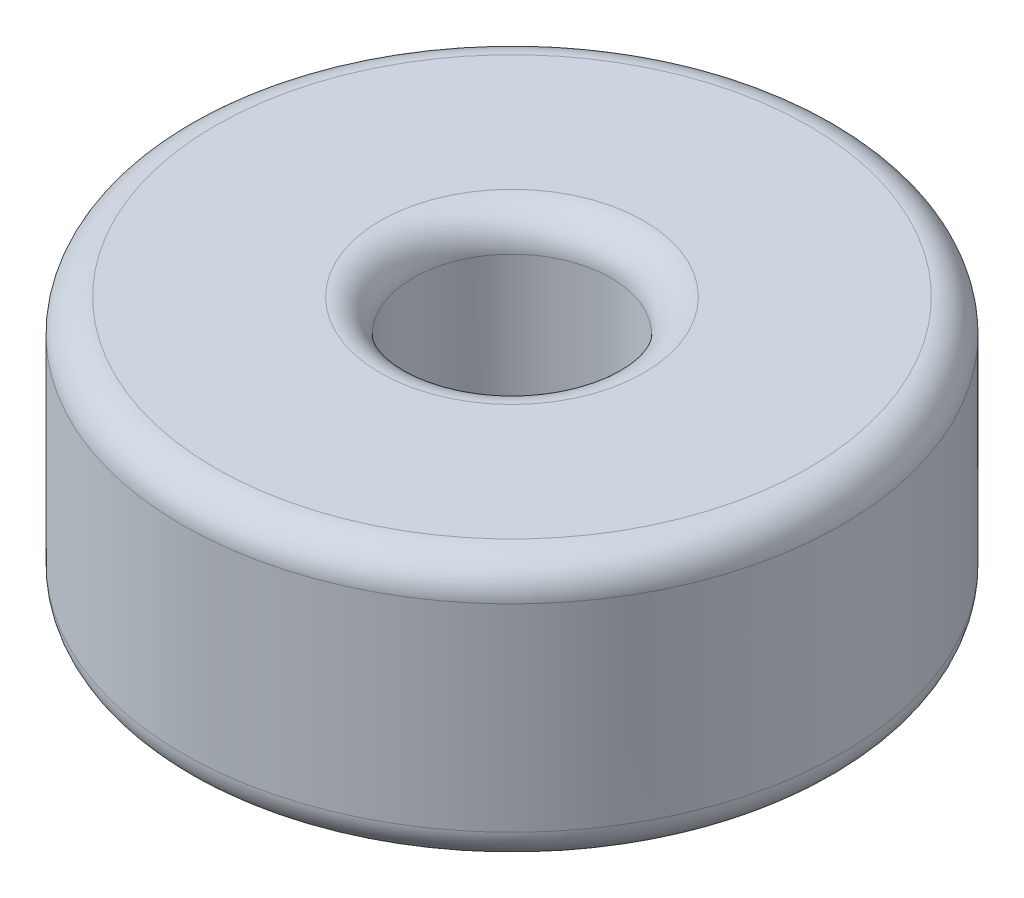
from build123d import *

# Parameters (mm, degrees)
ESQUISSE1_W = 3.5
ESQUISSE1_H = 4
CONG_1_R    = 0.5


with BuildPart() as part:
    # Esquisse1 → Révolution1 (revolve)
    with BuildSketch(Plane.XY, mode=Mode.PRIVATE) as r_volution1_sk:
        with Locations((3.25, 2)):
            Rectangle(ESQUISSE1_W, ESQUISSE1_H)
    revolve(r_volution1_sk.sketch.rotate(Axis((0, 0, 0), (0, 1, 0)), 90), axis=Axis((0, 0, 0), (0, 1, 0)))

    # Congé1
    cong_1_edges = [part.edges().sort_by_distance(p)[0] for p in [
        (0, 0, 1.5),
        (0, 0, 5),
        (0, 4, 5),
        (0, 4, 1.5),
    ]]
    fillet(cong_1_edges, radius=CONG_1_R)


solid = part.part
